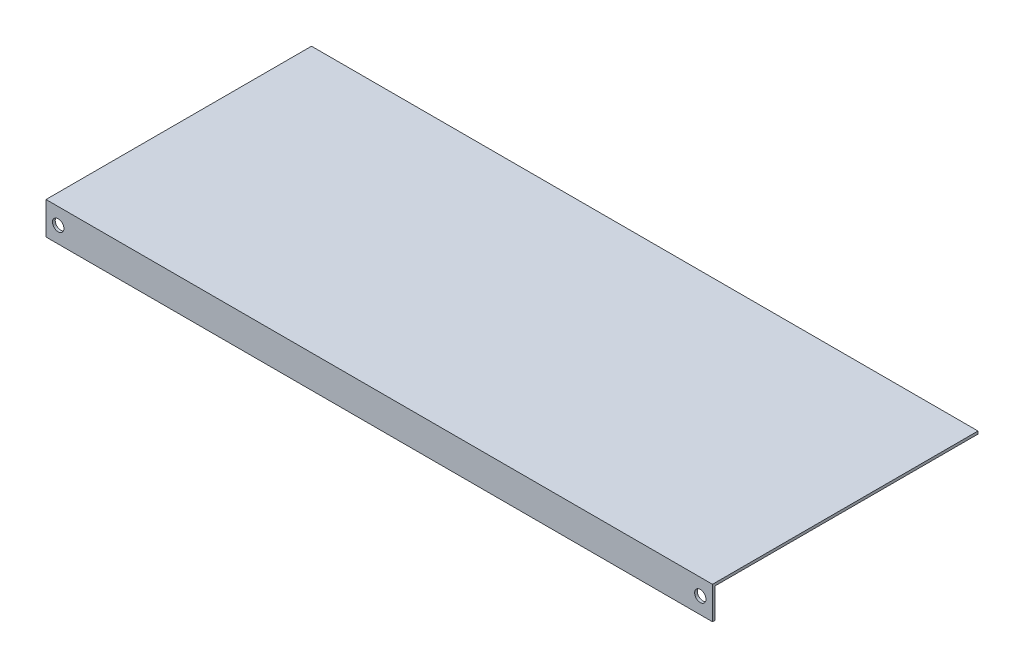
from build123d import *

# Parameters (mm, degrees)
SKETCH_1_W        = 246
SKETCH_1_H        = 98
EXTRUDE_1_DEPTH   = 1
SKETCH_2_W        = 246
SKETCH_2_H        = 1
EXTRUDE_2_DEPTH   = 11
HOLE_WIZARD_M41_D = 4.2


with BuildPart() as part:
    # Эскиз1 → Бобышка-Вытянуть1 (new body)
    with BuildSketch(Plane(origin=(0, 0, 0), x_dir=(1, 0, 0), z_dir=(0, 1, 0))):
        Rectangle(SKETCH_1_W, SKETCH_1_H)
    extrude(amount=EXTRUDE_1_DEPTH)

    # Эскиз2 → Бобышка-Вытянуть2 (add)
    with BuildSketch(Plane.XZ):
        with Locations((0, 48.5)):
            Rectangle(SKETCH_2_W, SKETCH_2_H)
    extrude(amount=EXTRUDE_2_DEPTH)

    # Сверло под метчик  спиральное M41 (through all)
    with Locations(Plane.XY.offset(49)):
        with Locations((118.5, -5), (-118.5, -5)):
            Hole(HOLE_WIZARD_M41_D / 2)


solid = part.part
